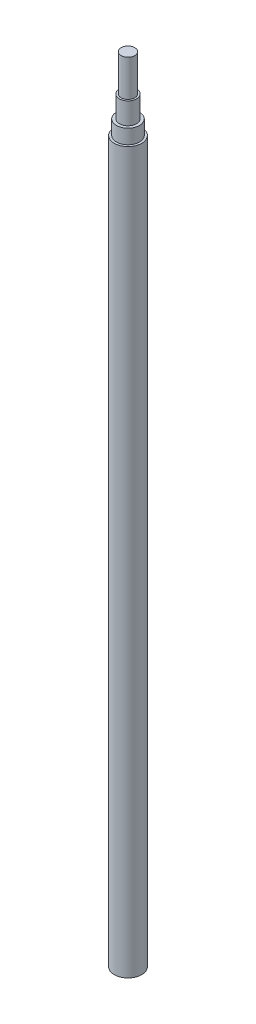
from build123d import *

# Parameters (mm, degrees)
SKETCH1_R           = 9.525
BOSS_EXTRUDE1_DEPTH = 500
SKETCH2_R           = 8
BOSS_EXTRUDE2_DEPTH = 10
SKETCH3_R           = 6
BOSS_EXTRUDE3_DEPTH = 15
SKETCH4_R           = 4.7625
BOSS_EXTRUDE4_DEPTH = 25.4


with BuildPart() as part:
    # Sketch1 → Boss-Extrude1 (new body)
    with BuildSketch(Plane(origin=(0, 0, 0), x_dir=(1, 0, 0), z_dir=(0, 1, 0))):
        with Locations(Location((0, 0, 0), (0, 0, 270))):
            Circle(SKETCH1_R)
    extrude(amount=BOSS_EXTRUDE1_DEPTH)

    # Sketch2 → Boss-Extrude2 (add)
    with BuildSketch(Plane(origin=(0, 500, 0), x_dir=(1, 0, 0), z_dir=(0, 1, 0))):
        with Locations(Location((0, 0, 0), (0, 0, 270))):
            Circle(SKETCH2_R)
    extrude(amount=BOSS_EXTRUDE2_DEPTH)

    # Sketch3 → Boss-Extrude3 (add)
    with BuildSketch(Plane(origin=(0, 510, 0), x_dir=(1, 0, 0), z_dir=(0, 1, 0))):
        with Locations(Location((0, 0, 0), (0, 0, 270))):
            Circle(SKETCH3_R)
    extrude(amount=BOSS_EXTRUDE3_DEPTH)

    # Sketch4 → Boss-Extrude4 (add)
    with BuildSketch(Plane(origin=(0, 525, 0), x_dir=(1, 0, 0), z_dir=(0, 1, 0))):
        with Locations(Location((0, 0, 0), (0, 0, 270))):
            Circle(SKETCH4_R)
    extrude(amount=BOSS_EXTRUDE4_DEPTH)


solid = part.part
